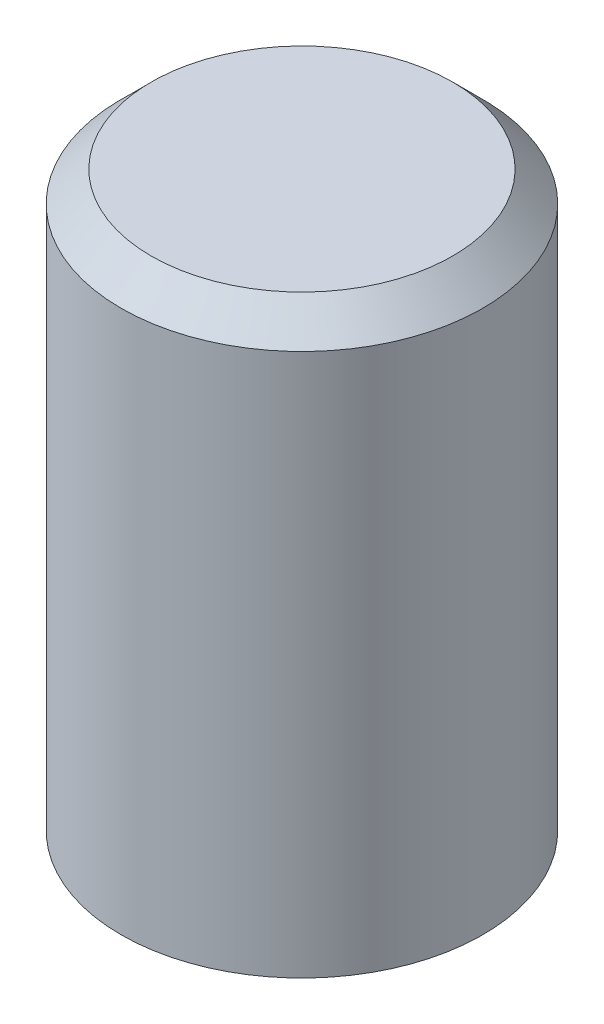
from build123d import *

# Parameters (mm, degrees)
SKIZZE1_R                       = 3
AUFSATZ_LINEAR_AUSTRAGEN1_DEPTH = 9.5
FASE1_SIZE                      = 0.5


with BuildPart() as part:
    # Skizze1 → Aufsatz-Linear austragen1 (new body)
    with BuildSketch(Plane(origin=(0, 0, 0), x_dir=(1, 0, 0), z_dir=(0, 1, 0))):
        with Locations(Location((0, 0, 0), (0, 0, 270))):
            Circle(SKIZZE1_R)
    extrude(amount=AUFSATZ_LINEAR_AUSTRAGEN1_DEPTH)

    # Fase1
    fase1_edges = [part.edges().sort_by_distance(p)[0] for p in [
        (0, 9.5, -3),
    ]]
    chamfer(fase1_edges, length=FASE1_SIZE)


solid = part.part
